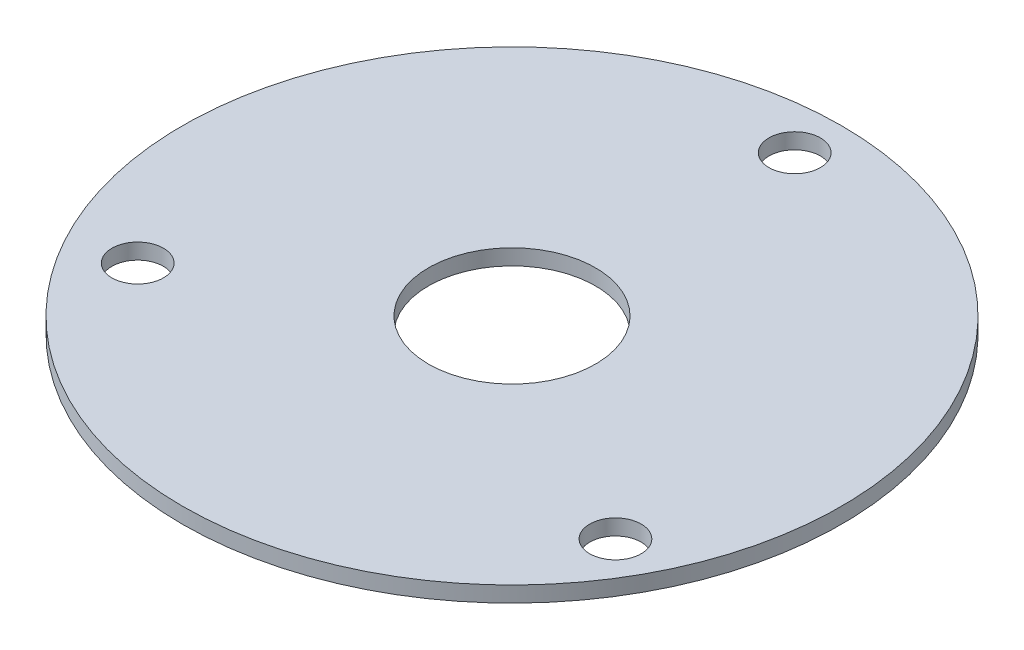
from build123d import *

# Parameters (mm, degrees)
SKETCH2_R           = 52.5
SKETCH2_R_2         = 13.3
BOSS_EXTRUDE1_DEPTH = 2.5
SKETCH3_R           = 4.1
CUT_EXTRUDE1_DEPTH  = 75.288289791


with BuildPart() as part:
    # Sketch2 → Boss-Extrude1 (new body)
    with BuildSketch(Plane(origin=(0, 0, 0), x_dir=(1, 0, 0), z_dir=(0, 1, 0))):
        with Locations(Location((0, 0, 0), (0, 0, 270))):
            Circle(SKETCH2_R)
        with Locations(Location((0, 0, 0), (0, 0, 270))):
            Circle(SKETCH2_R_2, mode=Mode.SUBTRACT)
    extrude(amount=BOSS_EXTRUDE1_DEPTH)

    # Sketch3 → Cut-Extrude1 (cut, through all)
    with BuildSketch(Plane(origin=(0, 2.5, 0), x_dir=(1, 0, 0), z_dir=(0, 1, 0))):
        with Locations(Location((0, 45.033320997, 0), (0, 0, 270))):
            Circle(SKETCH3_R)
        with Locations(Location((39, -22.516660498, 0), (0, 0, 270))):
            Circle(SKETCH3_R)
        with Locations(Location((-37.113866169, -22.516660498, 0), (0, 0, 270))):
            Circle(SKETCH3_R)
    extrude(amount=-CUT_EXTRUDE1_DEPTH, mode=Mode.SUBTRACT)


solid = part.part
